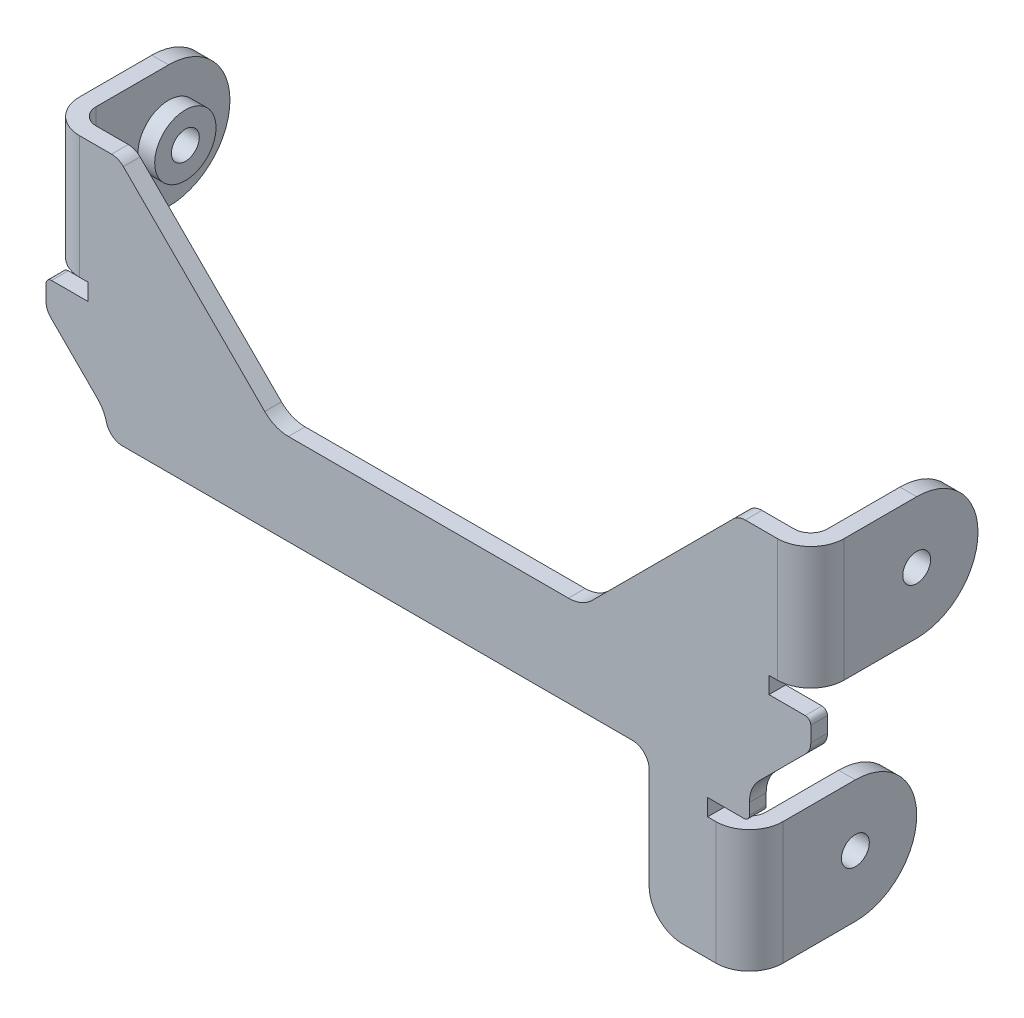
from build123d import *

# Parameters (mm, degrees)
SKETCH_1_W                  = 5.5
SKETCH_1_H                  = 12.242640687
EXTRUDE_1_DEPTH             = 1.5
SKETCH_2_W                  = 1.5
SKETCH_2_H                  = 24.742640687
EXTRUDE_2_DEPTH             = 55.6
SKETCH_3_W                  = 1.5
SKETCH_3_H                  = 11
EXTRUDE_3_DEPTH             = 2.25
SKETCH_4_W                  = 63.35
SKETCH_4_H                  = 1.5
EXTRUDE_4_DEPTH             = 11
EXTRUDE_5_DEPTH             = 1.5
EXTRUDE_6_DEPTH             = 1.5
SKETCH_7_W                  = 1.5
SKETCH_7_H                  = 11
EXTRUDE_7_DEPTH             = 2.25
EXTRUDE_START               = 1.5
EXTRUDE_8_DEPTH             = 1.5
SKETCH_9_W                  = 1.5
SKETCH_9_H                  = 23.242640687
EXTRUDE_9_DEPTH             = 3.75
SKETCH_10_W                 = 1.5
SKETCH_10_H                 = 10.742640687
EXTRUDE_10_DEPTH            = 3.75
SKETCH_11_W                 = 54.1
SKETCH_11_H                 = 13.565555211
CUT_EXTRUDE_1_DEPTH         = 87.841579903
CUT_EXTRUDE_2_DEPTH         = 88.087369922
CUT_EXTRUDE_3_DEPTH         = 87.841579903
CUT_EXTRUDE_4_DEPTH         = 87.841579903
SKETCH_15_W                 = 1.5
SKETCH_15_H                 = 2.75
SKETCH_16_W                 = 1.5
SKETCH_16_H                 = 2.75
SKETCH_17_W                 = 1.5
SKETCH_17_H                 = 2.75
HOLE_WIZARD_2_5_2_5_1_D     = 2.5
HOLE_WIZARD_2_5_2_5_1_DEPTH = 63.1
HOLE_WIZARD_2_5_2_5_2_D     = 2.5
HOLE_WIZARD_2_5_2_5_2_DEPTH = 3
HOLE_WIZARD_2_5_2_5_3_D     = 2.5
HOLE_WIZARD_2_5_2_5_3_DEPTH = 68.6
FILLET_1_R                  = 0.5
FILLET_2_R                  = 1.5
FILLET_3_R                  = 3


with BuildPart() as part:
    # 草图1 → 凸台-拉伸1 (new body)
    with BuildSketch(Plane.XY):
        with Locations((-9, 30.878679657)):
            Rectangle(SKETCH_1_W, SKETCH_1_H)
    extrude(amount=-EXTRUDE_1_DEPTH)

    # 草图2 → 凸台-拉伸2 (add)
    with BuildSketch(Plane.ZY.offset(11.75)):
        with Locations((-0.75, 24.628679657)):
            Rectangle(SKETCH_2_W, SKETCH_2_H)
    extrude(amount=EXTRUDE_2_DEPTH)

    # 草图3 → 凸台-拉伸3 (add)
    with BuildSketch(Plane(origin=(-11.75, 0, 0), x_dir=(0, 0, -1), z_dir=(1, 0, 0))):
        with Locations((0.75, 17.757359313)):
            Rectangle(SKETCH_3_W, SKETCH_3_H)
    extrude(amount=EXTRUDE_3_DEPTH)

    # 草图4 → 凸台-拉伸4 (add)
    with BuildSketch(Plane(origin=(0, 37, 0), x_dir=(-1, 0, 0), z_dir=(0, 1, 0))):
        with Locations((35.675, -0.75)):
            Rectangle(SKETCH_4_W, SKETCH_4_H)
    extrude(amount=EXTRUDE_4_DEPTH)

    # 草图5 → 凸台-拉伸5 (add)
    with BuildSketch(Plane(origin=(-4, 0, 0), x_dir=(0, 0, -1), z_dir=(1, 0, 0))):
        with BuildLine():
            Line((0, 48), (9.5, 48))
            ThreePointArc((9.5, 48), (15, 42.5), (9.5, 37))
            Line((9.5, 37), (0, 37))
            Line((0, 37), (0, 48))
        make_face()
    extrude(amount=EXTRUDE_5_DEPTH)

    # 草图6 → 凸台-拉伸6 (add)
    with BuildSketch(Plane(origin=(-9.5, 0, 0), x_dir=(0, 0, -1), z_dir=(1, 0, 0))):
        with BuildLine():
            Line((9.5, 12.257359313), (0, 12.257359313))
            Line((0, 12.257359313), (0, 23.257359313))
            Line((0, 23.257359313), (9.5, 23.257359313))
            ThreePointArc((9.5, 23.257359313), (15, 17.757359313), (9.5, 12.257359313))
        make_face()
    extrude(amount=EXTRUDE_6_DEPTH)

    # 草图7 → 凸台-拉伸7 (add)
    with BuildSketch(Plane.ZY.offset(67.35)):
        with Locations((-0.75, 42.5)):
            Rectangle(SKETCH_7_W, SKETCH_7_H)
    extrude(amount=EXTRUDE_7_DEPTH)

    # 草图8 → 凸台-拉伸8 (add)
    with BuildSketch(Plane.ZY.offset(69.6).offset(EXTRUDE_START)):
        with BuildLine():
            Line((-9.5, 48), (0, 48))
            Line((0, 48), (0, 37))
            Line((0, 37), (-9.5, 37))
            ThreePointArc((-9.5, 37), (-15, 42.5), (-9.5, 48))
        make_face()
    extrude(amount=-EXTRUDE_8_DEPTH)

    # 草图9 → 凸台-拉伸9 (add)
    with BuildSketch(Plane.ZY.offset(67.35)):
        with Locations((-0.75, 23.878679657)):
            Rectangle(SKETCH_9_W, SKETCH_9_H)
    extrude(amount=EXTRUDE_9_DEPTH)

    # 草图10 → 凸台-拉伸10 (add)
    with BuildSketch(Plane(origin=(-6.25, 0, 0), x_dir=(0, 0, -1), z_dir=(1, 0, 0))):
        with Locations((0.75, 30.128679657)):
            Rectangle(SKETCH_10_W, SKETCH_10_H)
    extrude(amount=EXTRUDE_10_DEPTH)

    # 草图11 → 切除-拉伸1 (cut, through all)
    with BuildSketch(Plane(origin=(0, 0, -1.5), x_dir=(-1, 0, 0), z_dir=(0, 0, -1))):
        with Locations((44.05, 19.040136919)):
            Rectangle(SKETCH_11_W, SKETCH_11_H)
    extrude(amount=-CUT_EXTRUDE_1_DEPTH, mode=Mode.SUBTRACT)

    # 草图12 → 切除-拉伸2 (cut, through all)
    with BuildSketch(Plane.XY):
        with BuildLine():
            Line((-71.1, 25.822914524), (-65.631623722, 25.822914524))
            ThreePointArc((-65.631623722, 25.822914524), (-65.752327832, 27.201161847), (-66.478679656, 28.378679656))
            Line((-66.478679656, 28.378679656), (-71.1, 33))
            Line((-71.1, 33), (-71.1, 25.822914524))
        make_face()
    extrude(amount=-CUT_EXTRUDE_2_DEPTH, mode=Mode.SUBTRACT)

    # 草图13 → 切除-拉伸3 (cut, through all)
    with BuildSketch(Plane(origin=(0, 0, -1.5), x_dir=(-1, 0, 0), z_dir=(0, 0, -1))):
        Polygon((8, 24.757359313), (8, 27.5), (2.5, 33), (2.5, 24.757359313), align=None)
    extrude(amount=-CUT_EXTRUDE_3_DEPTH, mode=Mode.SUBTRACT)

    # 草图14 → 切除-拉伸4 (cut, through all)
    with BuildSketch(Plane(origin=(0, 0, -1.5), x_dir=(-1, 0, 0), z_dir=(0, 0, -1))):
        Polygon((64.6, 48), (9, 48), (23, 34), (50.6, 34), align=None)
    extrude(amount=-CUT_EXTRUDE_4_DEPTH, mode=Mode.SUBTRACT)

    # 草图15 → 旋转1 (revolve)
    with BuildSketch(Plane.XY.offset(-9.5)):
        with Locations((-10.25, 19.132359313)):
            Rectangle(SKETCH_15_W, SKETCH_15_H)
    revolve(axis=Axis((-11, 17.757359313, -9.5), (1, 0, 0)))

    # 草图16 → 旋转2 (revolve)
    with BuildSketch(Plane.XY.offset(-9.5)):
        with Locations((-4.75, 43.875)):
            Rectangle(SKETCH_16_W, SKETCH_16_H)
    revolve(axis=Axis((-5.5, 42.5, -9.5), (1, 0, 0)))

    # 草图17 → 旋转3 (revolve)
    with BuildSketch(Plane(origin=(0, 0, -9.5), x_dir=(-1, 0, 0), z_dir=(0, 0, -1)), mode=Mode.PRIVATE) as revolve_3_sk:
        with Locations((68.85, 43.875)):
            Rectangle(SKETCH_17_W, SKETCH_17_H)
    revolve(revolve_3_sk.sketch.rotate(Axis((-68.1, 42.5, -9.5), (-1, 0, 0)), 180), axis=Axis((-68.1, 42.5, -9.5), (-1, 0, 0)))

    # Ø2.5 (2.5) 直径孔1
    with Locations(Plane(origin=(-8, 0, 0), x_dir=(0, 0, -1), z_dir=(1, 0, 0))):
        with Locations((9.5, 17.757359313)):
            Hole(HOLE_WIZARD_2_5_2_5_1_D / 2, depth=HOLE_WIZARD_2_5_2_5_1_DEPTH)

    # Ø2.5 (2.5) 直径孔2
    with Locations(Plane(origin=(-2.5, 0, 0), x_dir=(0, 0, -1), z_dir=(1, 0, 0))):
        with Locations((9.5, 42.5)):
            Hole(HOLE_WIZARD_2_5_2_5_2_D / 2, depth=HOLE_WIZARD_2_5_2_5_2_DEPTH)

    # Ø2.5 (2.5) 直径孔3
    with Locations(Plane.ZY.offset(71.1)):
        with Locations((-9.5, 42.5)):
            Hole(HOLE_WIZARD_2_5_2_5_3_D / 2, depth=HOLE_WIZARD_2_5_2_5_3_DEPTH)

    # 圆角1
    fillet_1_edges = [part.edges().sort_by_distance(p)[0] for p in [
        (-71.1, 35.5, -0.75),
        (-2.5, 35.5, -0.75),
        (-8, 24.757359313, -0.75),
    ]]
    fillet(fillet_1_edges, radius=FILLET_1_R)

    # 圆角2
    fillet_2_edges = [part.edges().sort_by_distance(p)[0] for p in [
        (-17, 25.822914524, -0.75),
        (-65.631623722, 25.822914524, -0.75),
        (-71.1, 33, -0.75),
        (-2.5, 33, -0.75),
        (-64.6, 48, -0.75),
        (-9, 48, -0.75),
        (-9.5, 17.757359313, -1.5),
        (-4, 42.5, -1.5),
        (-69.6, 42.5, -1.5),
    ]]
    fillet(fillet_2_edges, radius=FILLET_2_R)

    # 圆角3
    fillet_3_edges = [part.edges().sort_by_distance(p)[0] for p in [
        (-71.1, 42.5, 0),
        (-23, 34, -0.75),
        (-50.6, 34, -0.75),
        (-8, 27.5, -0.75),
        (-17, 12.257359313, -0.75),
        (-8, 17.757359313, 0),
        (-2.5, 42.5, 0),
    ]]
    fillet(fillet_3_edges, radius=FILLET_3_R)


solid = part.part
